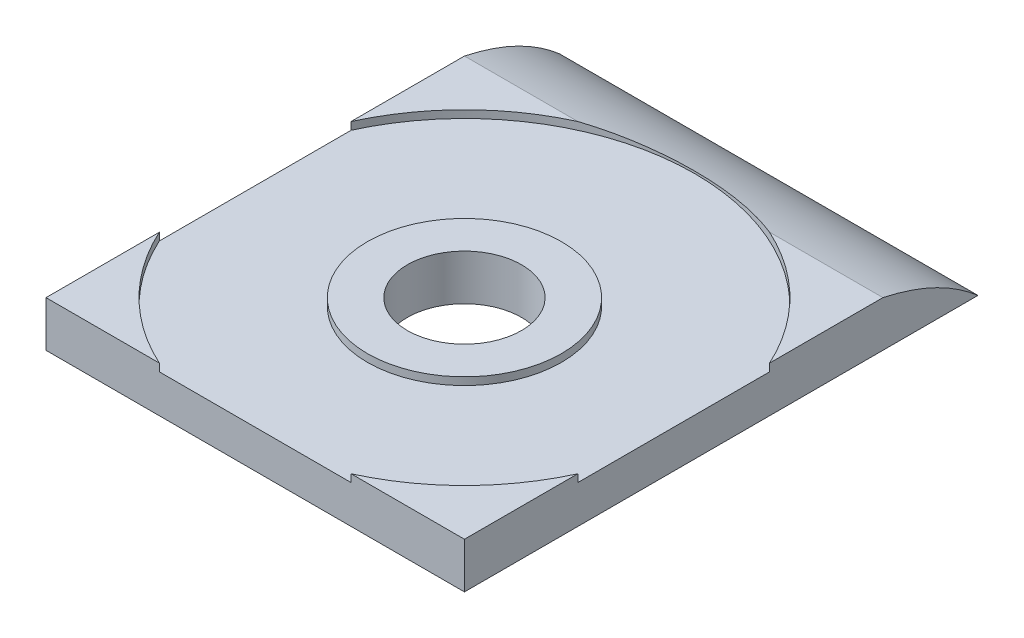
from build123d import *

# Parameters (mm, degrees)
SKETCH1_W           = 11
SKETCH1_H           = 11
SKETCH1_R           = 1.5
BOSS_EXTRUDE1_DEPTH = 1.2
SKETCH1_4_W         = 11
SKETCH1_4_H         = 2.5
BOSS_EXTRUDE2_DEPTH = 1.2
CUT_EXTRUDE1_DEPTH  = 14.654303351
SKETCH4_R           = 6.05
SKETCH4_R_2         = 2.55
CUT_EXTRUDE3_DEPTH  = 0.2


with BuildPart() as part:
    # Sketch1 → Boss-Extrude1 (new body)
    with BuildSketch(Plane(origin=(0, 0, 0), x_dir=(1, 0, 0), z_dir=(0, 1, 0))):
        Rectangle(SKETCH1_W, SKETCH1_H)
        Circle(SKETCH1_R, mode=Mode.SUBTRACT)
    extrude(amount=BOSS_EXTRUDE1_DEPTH)

    # Sketch1<4> → Boss-Extrude2 (add)
    with BuildSketch(Plane(origin=(0, 0, 0), x_dir=(1, 0, 0), z_dir=(0, 1, 0))):
        with Locations((0, 6.75)):
            Rectangle(SKETCH1_4_W, SKETCH1_4_H)
    extrude(amount=BOSS_EXTRUDE2_DEPTH)

    # Sketch3 → Cut-Extrude1 (cut, through all)
    with BuildSketch(Plane(origin=(5.5, 0, 0), x_dir=(0, 0, -1), z_dir=(1, 0, 0))):
        with BuildLine():
            Line((8, 1.2), (5.5, 1.2))
            add(Edge.make_bspline(
                [(5.5, 1.2), (6.993685342, 0.880481124), (8, 0)],
                knots=[0, 0, 0, 0.506360877, 0.506360877, 0.506360877], degree=2))
            Line((8, 0), (8, 1.2))
        make_face()
    extrude(amount=-CUT_EXTRUDE1_DEPTH, mode=Mode.SUBTRACT)

    # Sketch4 → Cut-Extrude3 (cut)
    with BuildSketch(Plane(origin=(0, 1.2, 0), x_dir=(1, 0, 0), z_dir=(0, 1, 0))):
        Circle(SKETCH4_R)
        Circle(SKETCH4_R_2, mode=Mode.SUBTRACT)
    extrude(amount=-CUT_EXTRUDE3_DEPTH, mode=Mode.SUBTRACT)


solid = part.part
